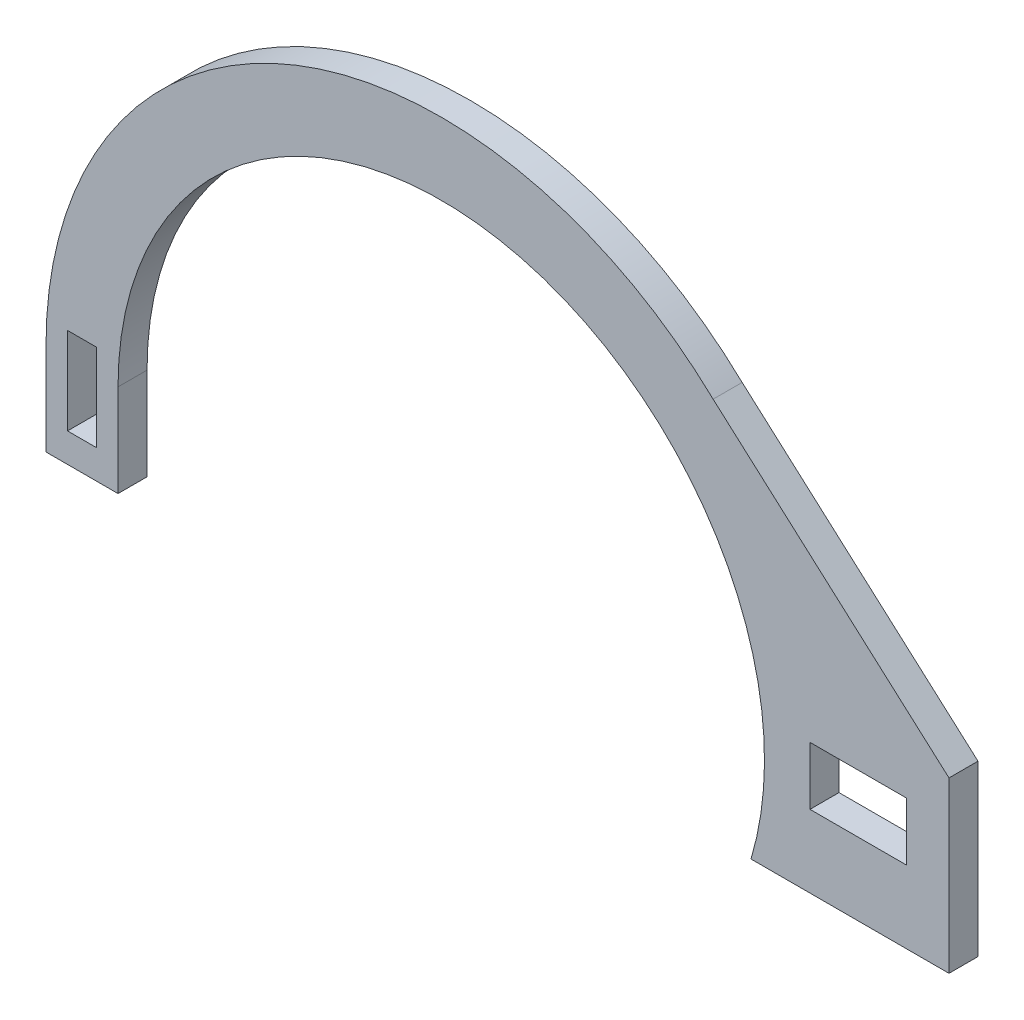
from build123d import *

# Parameters (mm, degrees)
SKETCH1_W           = 20
SKETCH1_H           = 12
BOSS_EXTRUDE1_DEPTH = 6
SKETCH2_W           = 6
SKETCH2_H           = 18
CUT_EXTRUDE1_DEPTH  = 10


with BuildPart() as part:
    # Sketch1 → Boss-Extrude1 (new body)
    with BuildSketch(Plane.XY):
        with BuildLine():
            Line((211.428617248, -24.317756725), (162.653205504, 19.127417073))
            ThreePointArc((162.653205504, 19.127417073), (74.134115414, 34.8851986), (24.686380191, -40.207134366))
            Line((24.686380191, -40.207134366), (24.686380191, -59.317756725))
            Line((24.686380191, -59.317756725), (39.581295698, -59.317756725))
            Line((39.581295698, -59.317756725), (39.581295698, -40.207134366))
            ThreePointArc((39.581295698, -40.207134366), (116.085216489, 25.939025685), (170.486001767, -59.317756725))
            Line((170.486001767, -59.317756725), (211.428617248, -59.317756725))
            Line((211.428617248, -59.317756725), (211.428617248, -24.317756725))
        make_face()
        with Locations((192.683627049, -38.317756725)):
            Rectangle(SKETCH1_W, SKETCH1_H, mode=Mode.SUBTRACT)
    extrude(amount=BOSS_EXTRUDE1_DEPTH)

    # Sketch2 → Cut-Extrude1 (cut)
    with BuildSketch(Plane(origin=(0, 0, 0), x_dir=(-1, 0, 0), z_dir=(0, 0, -1))):
        with Locations((-32.133837945, -44.317756725)):
            Rectangle(SKETCH2_W, SKETCH2_H)
    extrude(amount=-CUT_EXTRUDE1_DEPTH, mode=Mode.SUBTRACT)


solid = part.part
